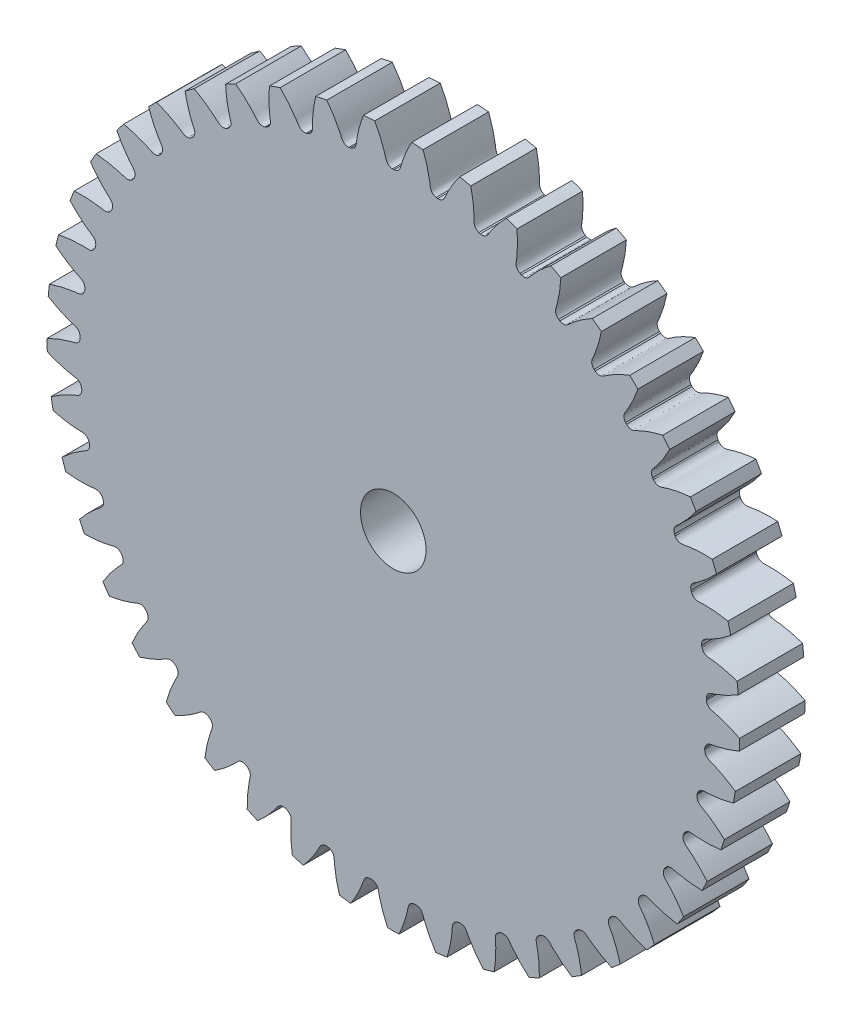
from build123d import *

# Parameters (mm, degrees)
SKETCH_1_R               = 10.575
EXTRUDE_1_DEPTH          = 2
CUT_EXTRUDE_1_DEPTH      = 16.088447568
PATTERN_CIRCULAR_1_COUNT = 45
SKETCH_4_R               = 1
CUT_EXTRUDE_2_DEPTH      = 16.087171728


with BuildPart() as part:
    # 草图1 → 凸台-拉伸1 (new body)
    with BuildSketch(Plane.XY):
        Circle(SKETCH_1_R)
    extrude(amount=EXTRUDE_1_DEPTH)

    # 草图2 → 切除-拉伸1 (cut, through all)
    with BuildSketch(Plane.XY):
        with BuildLine():
            ThreePointArc((0.023342969, 9.562471509), (0, 9.5625), (-0.023342969, 9.562471509))
            add(Edge.make_bspline(
                [(-0.023342969, 9.562471509), (-0.199607461, 9.586844803), (-0.219626048, 9.717635684), (-0.261281558, 9.859317988), (-0.277284473, 9.910665665), (-0.295569165, 9.965264052), (-0.316205369, 10.023079098), (-0.33934814, 10.084025868), (-0.365124689, 10.14802913), (-0.393667642, 10.215005532), (-0.425105138, 10.28486891), (-0.459563583, 10.357528808), (-0.497166714, 10.432890989), (-0.538035727, 10.510857368), (-0.582289116, 10.591326115), (-0.630042583, 10.674191716), (-0.681408937, 10.759345045), (-0.736497994, 10.846673436), (-0.795416486, 10.936060765), (-0.858267962, 11.027387522), (-0.925152697, 11.1205309), (-0.996167604, 11.21536487), (-1.071406141, 11.311760275), (-1.150958233, 11.409584913), (-1.234910175, 11.508703628), (-1.323344571, 11.608978406), (-1.416340208, 11.710268464), (-1.548269118, 11.848318659), (-1.651688099, 11.950153131), (-1.722848965, 12.017545794)],
                knots=[0, 0, 0, 0, 0.112268392, 0.128789174, 0.146568276, 0.165605699, 0.185901442, 0.207455506, 0.23026789, 0.254338595, 0.27966762, 0.306254966, 0.334100632, 0.363204619, 0.393566926, 0.425187554, 0.458066503, 0.492203772, 0.527599361, 0.564253271, 0.602165502, 0.641336053, 0.681764924, 0.723452116, 0.766397629, 0.810601462, 0.856063616, 0.90278409, 1, 1, 1, 1], degree=3))
            ThreePointArc((-1.722848965, 12.017545794), (0, 12.140412492), (1.722848965, 12.017545794))
            add(Edge.make_bspline(
                [(0.023342969, 9.562471509), (0.199607461, 9.586844803), (0.219626048, 9.717635684), (0.261281558, 9.859317988), (0.277284473, 9.910665665), (0.295569165, 9.965264052), (0.316205369, 10.023079098), (0.33934814, 10.084025868), (0.365124689, 10.14802913), (0.393667642, 10.215005532), (0.425105138, 10.28486891), (0.459563583, 10.357528808), (0.497166714, 10.432890989), (0.538035727, 10.510857368), (0.582289116, 10.591326115), (0.630042583, 10.674191716), (0.681408937, 10.759345045), (0.736497994, 10.846673436), (0.795416486, 10.936060765), (0.858267962, 11.027387522), (0.925152697, 11.1205309), (0.996167604, 11.21536487), (1.071406141, 11.311760275), (1.150958233, 11.409584913), (1.234910175, 11.508703628), (1.323344571, 11.608978406), (1.416340208, 11.710268464), (1.548269118, 11.848318659), (1.651688099, 11.950153131), (1.722848965, 12.017545794)],
                knots=[0, 0, 0, 0, 0.112268392, 0.128789174, 0.146568276, 0.165605699, 0.185901442, 0.207455506, 0.23026789, 0.254338595, 0.27966762, 0.306254966, 0.334100632, 0.363204619, 0.393566926, 0.425187554, 0.458066503, 0.492203772, 0.527599361, 0.564253271, 0.602165502, 0.641336053, 0.681764924, 0.723452116, 0.766397629, 0.810601462, 0.856063616, 0.90278409, 1, 1, 1, 1], degree=3))
        make_face()
    cut_extrude_1 = extrude(amount=CUT_EXTRUDE_1_DEPTH, mode=Mode.SUBTRACT)

    # 阵列(圆周)1: 切除-拉伸1 ×45 about axis
    pattern_circular_1_axis = Axis((0, 0, 2), (0, 0, -1))
    for i in range(1, PATTERN_CIRCULAR_1_COUNT):
        add(cut_extrude_1.rotate(pattern_circular_1_axis, i * 360 / PATTERN_CIRCULAR_1_COUNT), mode=Mode.SUBTRACT)

    # 草图4 → 切除-拉伸2 (cut, through all)
    with BuildSketch(Plane.XY.offset(2)):
        Circle(SKETCH_4_R)
    extrude(amount=-CUT_EXTRUDE_2_DEPTH, mode=Mode.SUBTRACT)


solid = part.part
